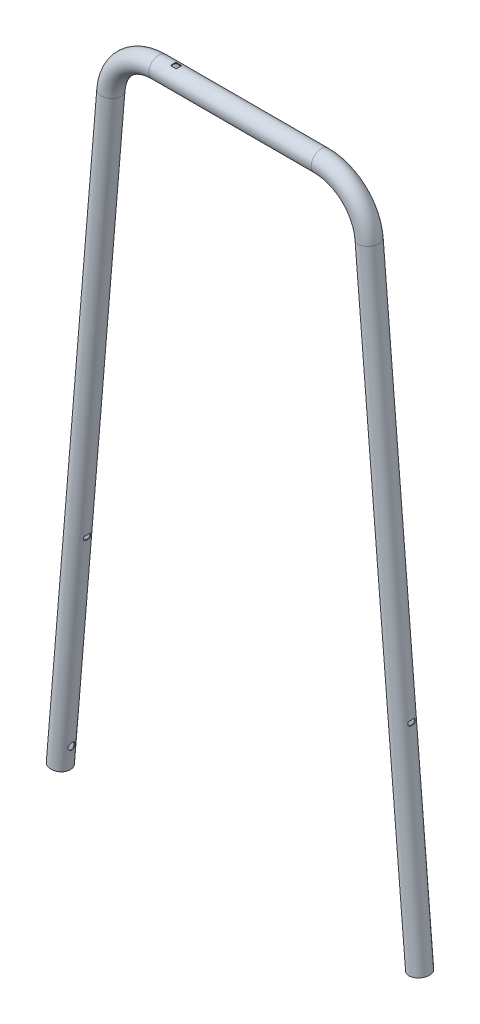
from build123d import *

# Parameters (mm, degrees)
SKETCH2_R           = 11
SKETCH2_R_2         = 10.2
SKETCH17_R          = 4
CUT_EXTRUDE6_DEPTH  = 50
CUT_EXTRUDE7_DEPTH  = 50
SKETCH19_R          = 4
CUT_EXTRUDE8_DEPTH  = 50
SKETCH20_R          = 3.1
CUT_EXTRUDE9_DEPTH  = 50
CUT_EXTRUDE10_DEPTH = 10


with BuildPart() as part:
    # Sweep2: sweep along a path in Sketch1
    with BuildLine(Plane.XY) as sweep2_path:
        Line((198, -162.284032228), (142.294983498, 508.10480277))
        ThreePointArc((142.294983498, 508.10480277), (125.368457539, 542.713456504), (89.477011865, 556.715967772))
        Line((89.477011865, 556.715967772), (-89.477011865, 556.715967772))
        ThreePointArc((-89.477011865, 556.715967772), (-125.368457539, 542.713456504), (-142.294983498, 508.10480277))
        Line((-142.294983498, 508.10480277), (-198, -162.284032228))
    # Sketch2 → Sweep2 (sweep)
    with BuildSketch(Plane(origin=(-198, -162.284032228, 0), x_dir=(-0.9965655024977618, 0.08280820751220104, 0), z_dir=(-0.08280820751220103, -0.9965655024977617, 0))):
        Circle(SKETCH2_R)
        Circle(SKETCH2_R_2, mode=Mode.SUBTRACT)
    sweep(path=sweep2_path.line)

    # Sketch17 → Cut-Extrude6 (cut)
    with BuildSketch(Plane(origin=(-198, -162.284032228, 0), x_dir=(0, 0, 1), z_dir=(-0.9965655024977617, 0.08280820751220212, 0))):
        with Locations((0, 23.5)):
            Circle(SKETCH17_R)
    cut_extrude6 = extrude(amount=-CUT_EXTRUDE6_DEPTH, mode=Mode.SUBTRACT)

    # Sketch18 → Cut-Extrude7 (cut, symmetric)
    with BuildSketch(Plane(origin=(-198, -162.284032228, 0), x_dir=(0, 0, 1), z_dir=(-0.9965655024977617, 0.08280820751220212, 0))):
        with BuildLine():
            Line((-2, 235), (2, 235))
            ThreePointArc((2, 235), (3.414213562, 234.414213562), (4, 233))
            Line((4, 233), (4, 232))
            ThreePointArc((4, 232), (3.414213562, 230.585786438), (2, 230))
            Line((2, 230), (-2, 230))
            ThreePointArc((-2, 230), (-3.414213562, 230.585786438), (-4, 232))
            Line((-4, 232), (-4, 233))
            ThreePointArc((-4, 233), (-3.414213562, 234.414213562), (-2, 235))
        make_face()
    cut_extrude7 = extrude(amount=CUT_EXTRUDE7_DEPTH, both=True, mode=Mode.SUBTRACT)

    # Mirror2: Cut-Extrude6, Cut-Extrude7 across plane
    add(cut_extrude6.mirror(Plane(origin=(0, 0, 0), x_dir=(0, 0, 1), z_dir=(1, 0, 0))), mode=Mode.SUBTRACT)
    add(cut_extrude7.mirror(Plane(origin=(0, 0, 0), x_dir=(0, 0, 1), z_dir=(1, 0, 0))), mode=Mode.SUBTRACT)

    # Sketch19 → Cut-Extrude8 (cut)
    with BuildSketch(Plane(origin=(-198, -162.284032228, 0), x_dir=(0, 0, 1), z_dir=(-0.9965655024977617, 0.08280820751220212, 0))):
        with Locations((0, 493.5)):
            Circle(SKETCH19_R)
    extrude(amount=CUT_EXTRUDE8_DEPTH, mode=Mode.SUBTRACT)

    # Sketch20 → Cut-Extrude9 (cut)
    with BuildSketch(Plane(origin=(0, 567.715967772, 0), x_dir=(1, 0, 0), z_dir=(0, 1, 0))):
        with Locations((-70.062220527, 0)):
            Circle(SKETCH20_R)
    extrude(amount=-CUT_EXTRUDE9_DEPTH, mode=Mode.SUBTRACT)

    # Sketch21 → Cut-Extrude10 (cut)
    with BuildSketch(Plane(origin=(0, 567.715967772, 0), x_dir=(1, 0, 0), z_dir=(0, 1, 0))):
        with BuildLine():
            Line((-72.312220527, -3.1), (-67.812220527, -3.1))
            ThreePointArc((-67.812220527, -3.1), (-67.105113746, -2.807106781), (-66.812220527, -2.1))
            Line((-66.812220527, -2.1), (-66.812220527, 2.1))
            ThreePointArc((-66.812220527, 2.1), (-67.105113746, 2.807106781), (-67.812220527, 3.1))
            Line((-67.812220527, 3.1), (-72.312220527, 3.1))
            ThreePointArc((-72.312220527, 3.1), (-73.019327309, 2.807106781), (-73.312220527, 2.1))
            Line((-73.312220527, 2.1), (-73.312220527, -2.1))
            ThreePointArc((-73.312220527, -2.1), (-73.019327309, -2.807106781), (-72.312220527, -3.1))
        make_face()
    extrude(amount=-CUT_EXTRUDE10_DEPTH, mode=Mode.SUBTRACT)


solid = part.part
